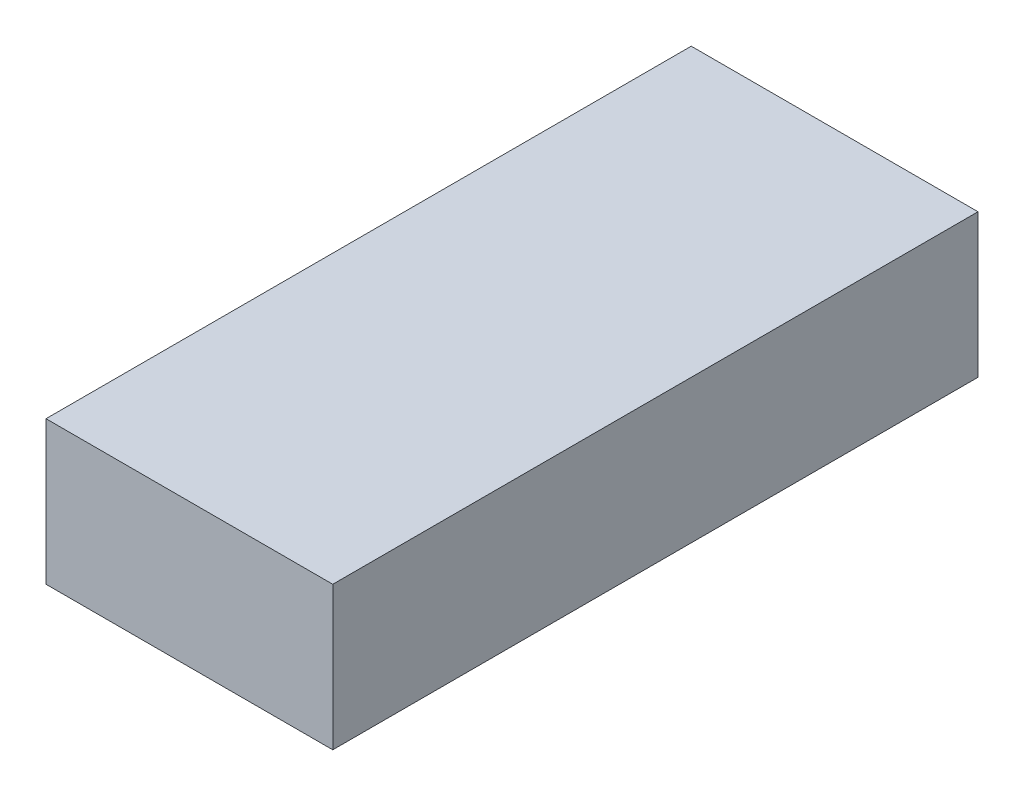
from build123d import *

# Parameters (mm, degrees)
SKETCH1_W           = 20
SKETCH1_H           = 45
BOSS_EXTRUDE1_DEPTH = 10


with BuildPart() as part:
    # Sketch1 → Boss-Extrude1 (new body)
    with BuildSketch(Plane(origin=(0, 0, 0), x_dir=(1, 0, 0), z_dir=(0, 1, 0))):
        with Locations((10, 22.5)):
            Rectangle(SKETCH1_W, SKETCH1_H)
    extrude(amount=BOSS_EXTRUDE1_DEPTH)


solid = part.part
